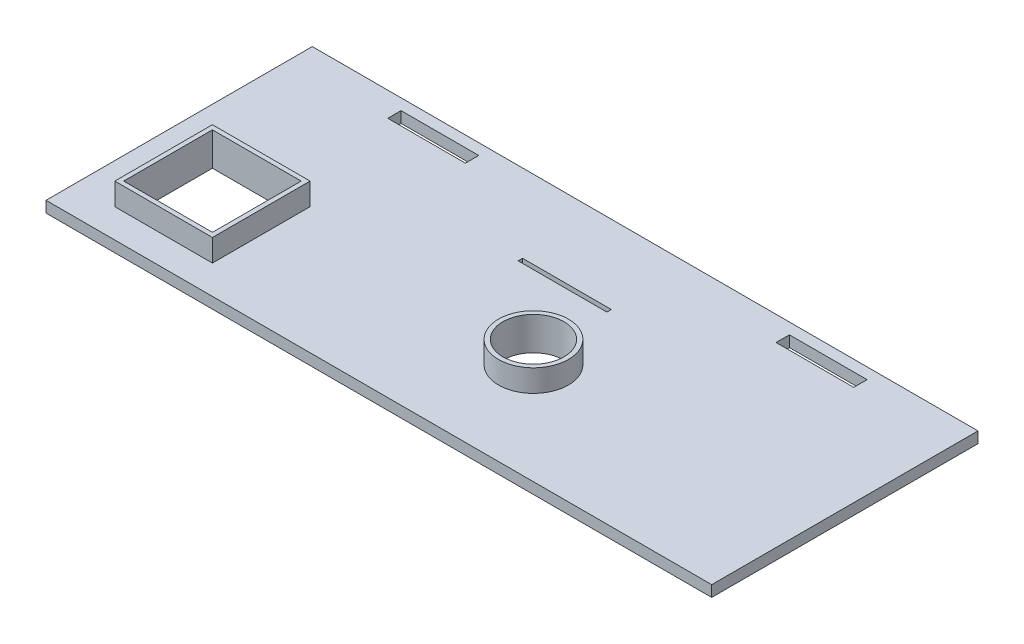
from build123d import *

# Parameters (mm, degrees)
SKETCH1_W           = 300
SKETCH1_H           = 120
SKETCH1_R           = 13.75
SKETCH1_W_2         = 35
SKETCH1_H_2         = 6
SKETCH1_W_3         = 40
SKETCH1_H_3         = 40
SKETCH1_H_4         = 2
BOSS_EXTRUDE1_DEPTH = 5
SKETCH3_R           = 15.75
SKETCH3_R_2         = 13.75
SKETCH3_W           = 44
SKETCH3_H           = 44
SKETCH3_W_2         = 40
SKETCH3_H_2         = 40
BOSS_EXTRUDE5_DEPTH = 10


with BuildPart() as part:
    # Sketch1 → Boss-Extrude1 (new body)
    with BuildSketch(Plane(origin=(0, 0, 0), x_dir=(1, 0, 0), z_dir=(0, 1, 0))):
        Rectangle(SKETCH1_W, SKETCH1_H)
        with Locations(Location((24.074387053, -14.407309066, 0), (0, 0, 270))):
            Circle(SKETCH1_R, mode=Mode.SUBTRACT)
        with Locations((-87.5, 52)):
            Rectangle(SKETCH1_W_2, SKETCH1_H_2, mode=Mode.SUBTRACT)
        with Locations((87.5, 52)):
            Rectangle(SKETCH1_W_2, SKETCH1_H_2, mode=Mode.SUBTRACT)
        with Locations((-110, -25)):
            Rectangle(SKETCH1_W_3, SKETCH1_H_3, mode=Mode.SUBTRACT)
        with Locations((0, 23.756786453)):
            Rectangle(SKETCH1_W_3, SKETCH1_H_4, mode=Mode.SUBTRACT)
    extrude(amount=BOSS_EXTRUDE1_DEPTH)

    # Sketch3 → Boss-Extrude5 (add)
    # profile 1 of 2: a face of its own
    with BuildSketch(Plane(origin=(0, 5, 0), x_dir=(1, 0, 0), z_dir=(0, 1, 0))):
        with Locations(Location((24.074387053, -14.407309066, 0), (0, 0, 90))):
            Circle(SKETCH3_R)
        with Locations(Location((24.074387053, -14.407309066, 0), (0, 0, 270))):
            Circle(SKETCH3_R_2, mode=Mode.SUBTRACT)
    # profile 2 of 2: a face of its own
    with BuildSketch(Plane(origin=(0, 5, 0), x_dir=(1, 0, 0), z_dir=(0, 1, 0))):
        with Locations((-110, -25)):
            Rectangle(SKETCH3_W, SKETCH3_H)
        with Locations((-110, -25)):
            Rectangle(SKETCH3_W_2, SKETCH3_H_2, mode=Mode.SUBTRACT)
    extrude(amount=BOSS_EXTRUDE5_DEPTH)


solid = part.part
